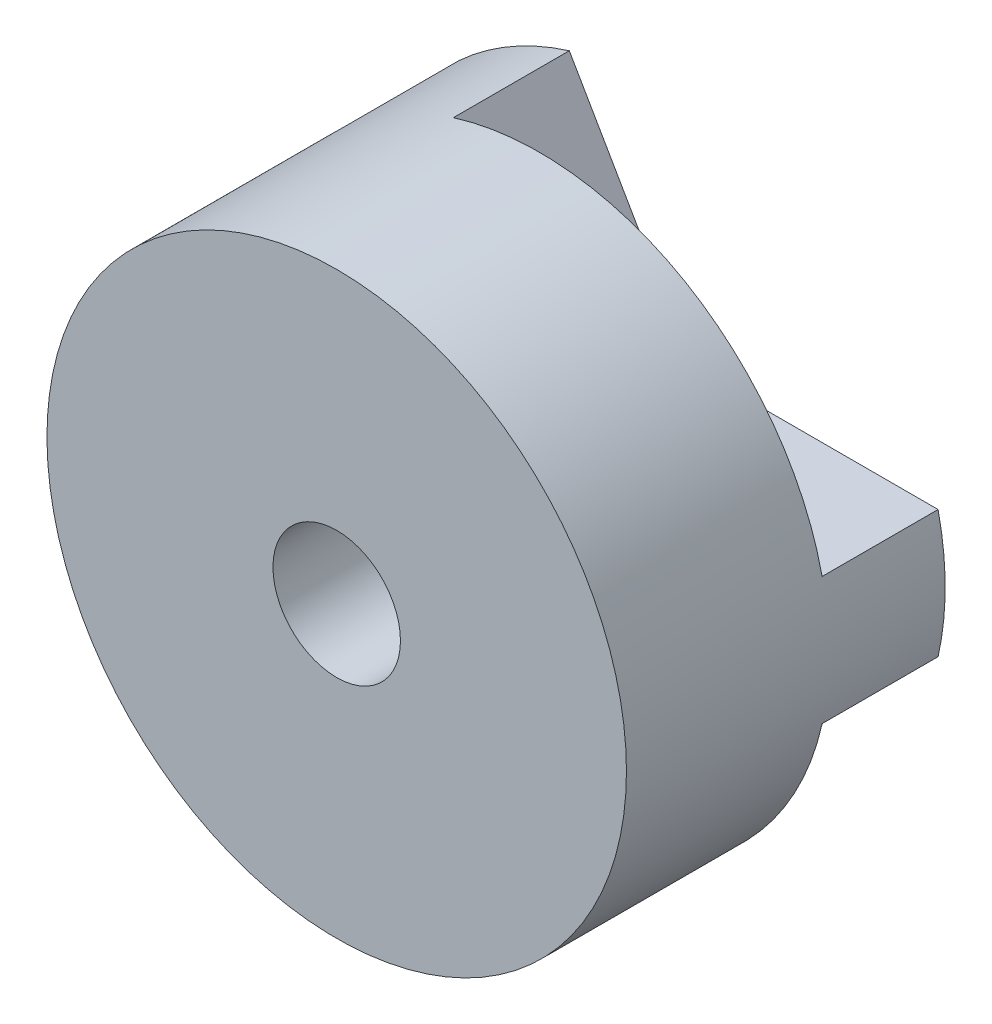
from build123d import *

# Parameters (mm, degrees)
SKETCH1_R           = 50
SKETCH1_R_2         = 11
BOSS_EXTRUDE1_DEPTH = 55
CUT_EXTRUDE2_DEPTH  = 20


with BuildPart() as part:
    # Sketch1 → Boss-Extrude1 (new body)
    with BuildSketch(Plane.XY):
        Circle(SKETCH1_R)
        Circle(SKETCH1_R_2, mode=Mode.SUBTRACT)
    extrude(amount=BOSS_EXTRUDE1_DEPTH)

    # Sketch3 → Cut-Extrude2 (cut)
    with BuildSketch(Plane(origin=(0, 0, 0), x_dir=(-1, 0, 0), z_dir=(0, 0, -1))):
        with BuildLine():
            Line((-48.774993593, -11), (-17.145475472, -11))
            ThreePointArc((-17.145475472, -11), (-20.370746897, 0), (-17.145475472, 11))
            Line((-17.145475472, 11), (-48.774993593, 11))
            ThreePointArc((-48.774993593, 11), (-25, 43.301270189), (14.861217355, 47.740383521))
            Line((14.861217355, 47.740383521), (-0.953541706, 20.348417319))
            ThreePointArc((-0.953541706, 20.348417319), (10.185373449, 17.641584307), (18.099017178, 9.348417319))
            Line((18.099017178, 9.348417319), (33.913776238, 36.740383521))
            ThreePointArc((33.913776238, 36.740383521), (50, 0), (33.913776238, -36.740383521))
            Line((33.913776238, -36.740383521), (18.099017178, -9.348417319))
            ThreePointArc((18.099017178, -9.348417319), (10.185373449, -17.641584307), (-0.953541706, -20.348417319))
            Line((-0.953541706, -20.348417319), (14.861217355, -47.740383521))
            ThreePointArc((14.861217355, -47.740383521), (-25, -43.301270189), (-48.774993593, -11))
        make_face()
    extrude(amount=-CUT_EXTRUDE2_DEPTH, mode=Mode.SUBTRACT)


solid = part.part
